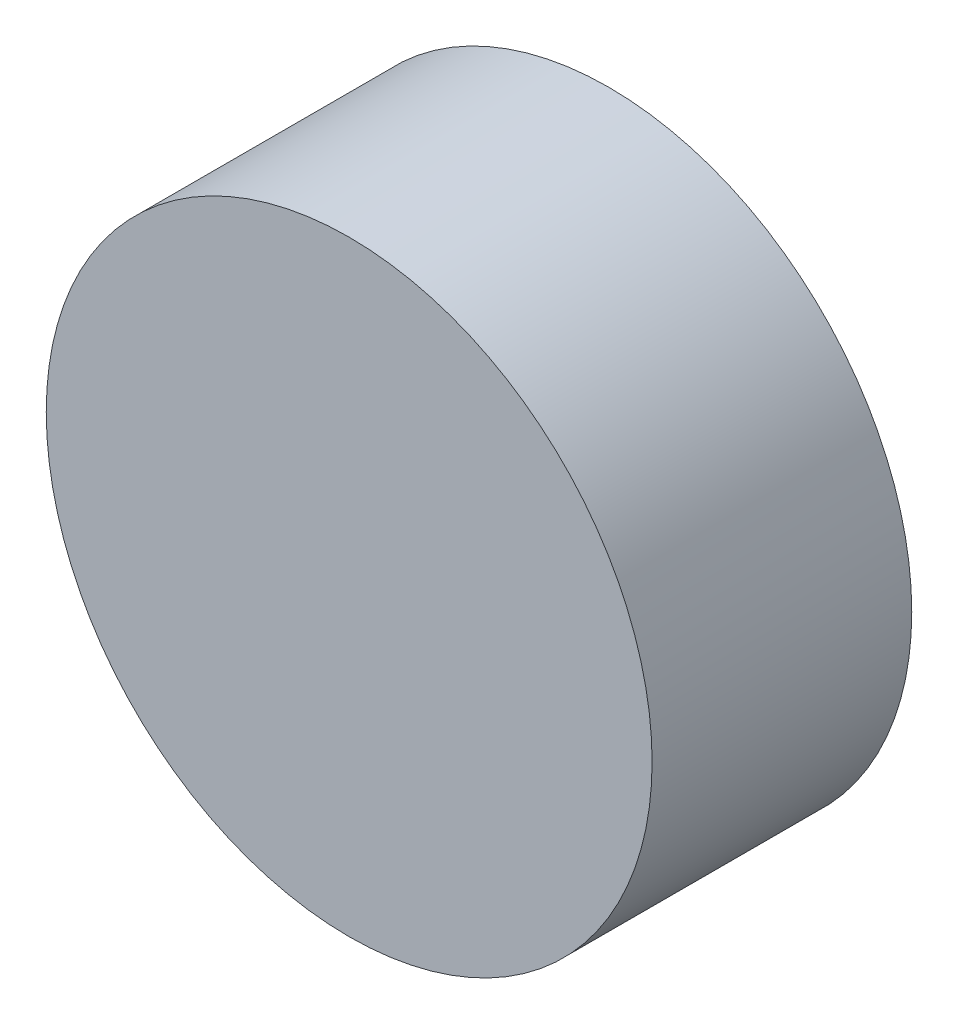
from build123d import *

# Parameters (mm, degrees)
SKETCH_1_R      = 31.5
EXTRUDE_1_DEPTH = 27


with BuildPart() as part:
    # 草圖1 → 填料-伸長1 (new body)
    with BuildSketch(Plane.XY):
        Circle(SKETCH_1_R)
    extrude(amount=EXTRUDE_1_DEPTH)


solid = part.part
